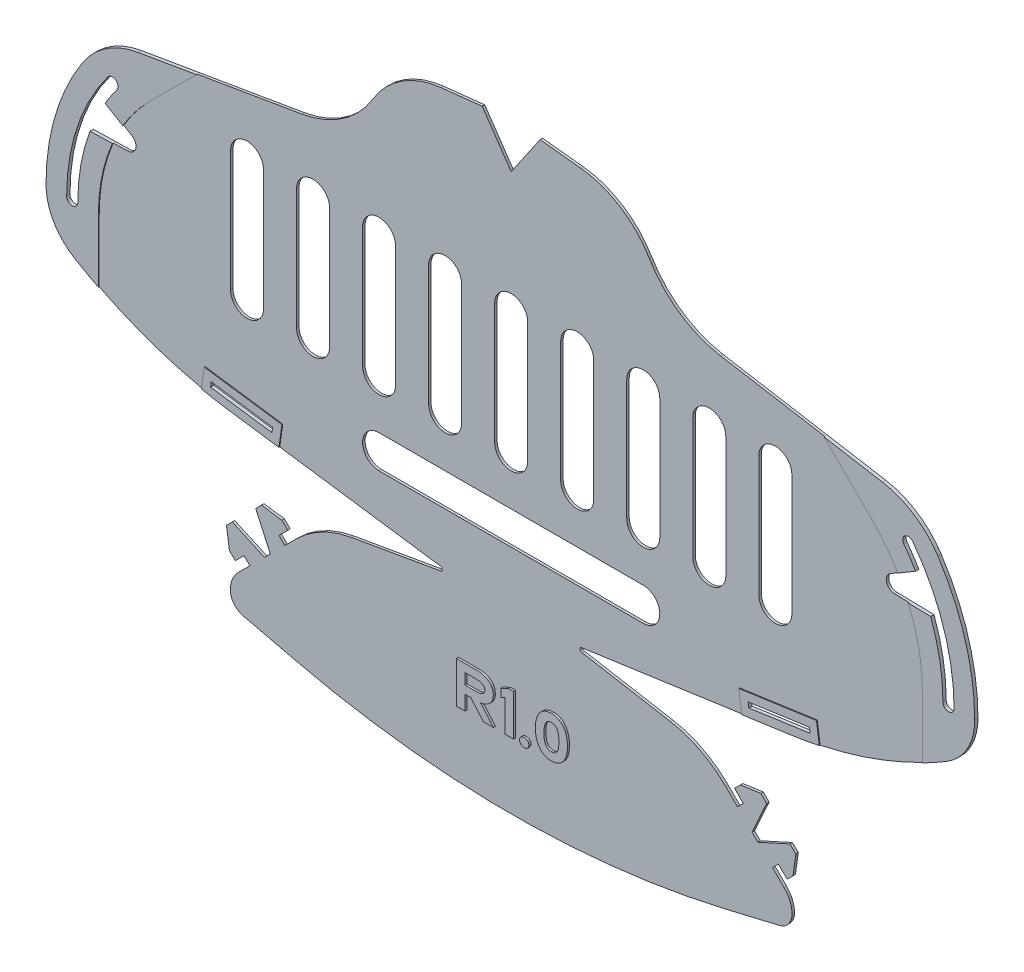
from build123d import *

# Parameters (mm, degrees)
MAIN_SHAPE_DEPTH                   = 0.6
ELASTIC_ATTACHMENT_POINTS_DEPTH    = 184.525502315
REINFORCED_ATTACHMENT_POINTS_DEPTH = 0.2
TAB_SLITS_DEPTH                    = 184.525502315
REINFORCED_TAB_SLITS_DEPTH         = 0.2
TAB_FLEX_RELIEF_DEPTH              = 184.525502315
TAB_FLEX_RELIEF_DEPTH_BACK         = 184.525502315
BREATHING_SLITS_DEPTH              = 184.525502315
VERSION_NUMBER_DEPTH               = 0.5
FILLET1_R                          = 0.5
CUT_EXTRUDE1_DEPTH                 = 184.526265229
CUT_EXTRUDE1_DEPTH_BACK            = 184.526265229


with BuildPart() as part:
    # Sketch1 → Main Shape (new body)
    with BuildSketch(Plane.XY):
        with BuildLine():
            Line((0, -10.235233266), (-7, 0))
            Line((-7, 0), (-16.941855461, -1.076805455))
            ThreePointArc((-16.941855461, -1.076805455), (-26.448172688, -4.42923559), (-33.461443341, -11.669600897))
            ThreePointArc((-33.461443341, -11.669600897), (-40.804108255, -19.481824954), (-50.74391922, -23.5))
            Line((-50.74391922, -23.5), (-90.180351554, -30.190874742))
            ThreePointArc((-90.180351554, -30.190874742), (-97.811505455, -33.190405434), (-103.597722286, -39))
            ThreePointArc((-103.597722286, -39), (-110.227482046, -53.35351039), (-112.5, -69))
            ThreePointArc((-112.5, -69), (-110.685143325, -75.893640703), (-105.711102551, -81))
            ThreePointArc((-105.711102551, -81), (-87.655491519, -89.524485559), (-68.266232563, -94.291935705))
            Line((-68.266232563, -94.291935705), (-14, -102))
            Line((-14, -102), (-38.626554922, -106.304973016))
            ThreePointArc((-38.626554922, -106.304973016), (-45.849449199, -108.748014338), (-52, -113.254607005))
            Line((-52, -113.254607005), (-54.828307349, -116.0831539))
            Line((-54.828307349, -116.0831539), (-56.242580797, -114.669000226))
            Line((-56.242580797, -114.669000226), (-54.121350285, -112.547590054))
            Line((-54.121350285, -112.547590054), (-55.535623732, -111.13343638))
            Line((-55.535623732, -111.13343638), (-60.48540114, -110.426539202))
            Line((-60.48540114, -110.426539202), (-68.970323187, -118.912179887))
            Line((-68.970323187, -118.912179887), (-68.263006804, -123.861897408))
            Line((-68.263006804, -123.861897408), (-66.848733357, -125.276051082))
            Line((-66.848733357, -125.276051082), (-64.727502845, -123.154640911))
            Line((-64.727502845, -123.154640911), (-63.313229397, -124.568794586))
            Line((-63.313229397, -124.568794586), (-66.141536747, -127.397341481))
            ThreePointArc((-66.141536747, -127.397341481), (-67.550417669, -129.506025763), (-68.045148042, -131.993340924))
            ThreePointArc((-68.045148042, -131.993340924), (-67.183295285, -134.473669911), (-64.9691321, -135.885159709))
            Line((-64.9691321, -135.885159709), (-52.436095294, -138.860716087))
            ThreePointArc((-52.436095294, -138.860716087), (-26.397134772, -143.459954927), (0, -145))
            ThreePointArc((0, -145), (26.397134772, -143.459954927), (52.436095294, -138.860716087))
            Line((52.436095294, -138.860716087), (64.9691321, -135.885159709))
            ThreePointArc((64.9691321, -135.885159709), (67.183295285, -134.473669911), (68.045148042, -131.993340924))
            ThreePointArc((68.045148042, -131.993340924), (67.550417669, -129.506025763), (66.141536747, -127.397341481))
            Line((66.141536747, -127.397341481), (63.313229397, -124.568794586))
            Line((63.313229397, -124.568794586), (64.727502845, -123.154640911))
            Line((64.727502845, -123.154640911), (66.848733357, -125.276051082))
            Line((66.848733357, -125.276051082), (68.263006804, -123.861897408))
            Line((68.263006804, -123.861897408), (68.970323187, -118.912179887))
            Line((68.970323187, -118.912179887), (60.48540114, -110.426539202))
            Line((60.48540114, -110.426539202), (55.535623732, -111.13343638))
            Line((55.535623732, -111.13343638), (54.121350285, -112.547590054))
            Line((54.121350285, -112.547590054), (56.242580797, -114.669000226))
            Line((56.242580797, -114.669000226), (54.828307349, -116.0831539))
            Line((54.828307349, -116.0831539), (52, -113.254607005))
            ThreePointArc((52, -113.254607005), (45.849449199, -108.748014338), (38.626554922, -106.304973016))
            Line((38.626554922, -106.304973016), (14, -102))
            Line((14, -102), (68.266232563, -94.291935705))
            ThreePointArc((68.266232563, -94.291935705), (87.655491519, -89.524485559), (105.711102551, -81))
            ThreePointArc((105.711102551, -81), (110.685143325, -75.893640703), (112.5, -69))
            ThreePointArc((112.5, -69), (110.227482046, -53.35351039), (103.597722286, -39))
            ThreePointArc((103.597722286, -39), (97.811505455, -33.190405434), (90.180351554, -30.190874742))
            Line((90.180351554, -30.190874742), (50.74391922, -23.5))
            ThreePointArc((50.74391922, -23.5), (40.804108255, -19.481824954), (33.461443341, -11.669600897))
            ThreePointArc((33.461443341, -11.669600897), (26.448172688, -4.42923559), (16.941855461, -1.076805455))
            Line((16.941855461, -1.076805455), (7, 0))
            Line((7, 0), (0, -10.235233266))
        make_face()
    extrude(amount=MAIN_SHAPE_DEPTH)

    # Sketch2 → Elastic Attachment Points (cut, through all)
    with BuildSketch(Plane.XY.offset(0.6)):
        with BuildLine():
            ThreePointArc((-97.5, -39), (-104.934164903, -53.188611699), (-107.5, -69))
            ThreePointArc((-107.5, -69), (-106.15, -70.35), (-104.8, -69))
            ThreePointArc((-104.8, -69), (-102.372719998, -54.042426667), (-95.34, -40.62))
            ThreePointArc((-95.34, -40.62), (-95.61, -38.73), (-97.5, -39))
        make_face()
        with BuildLine():
            ThreePointArc((97.5, -39), (104.934164903, -53.188611699), (107.5, -69))
            ThreePointArc((107.5, -69), (106.15, -70.35), (104.8, -69))
            ThreePointArc((104.8, -69), (102.372719998, -54.042426667), (95.34, -40.62))
            ThreePointArc((95.34, -40.62), (95.61, -38.73), (97.5, -39))
        make_face()
    extrude(amount=-ELASTIC_ATTACHMENT_POINTS_DEPTH, mode=Mode.SUBTRACT)

    # Sketch7 → Reinforced Attachment Points (add)
    # profile 1 of 2: a face of its own
    with BuildSketch(Plane.XY.offset(0.6)):
        with BuildLine():
            Line((-99.8, -69), (-99.8, -84.285345235))
            ThreePointArc((-99.8, -84.285345235), (-102.78333163, -82.692655957), (-105.711102551, -81))
            ThreePointArc((-105.711102551, -81), (-110.685143325, -75.893640703), (-112.5, -69))
            ThreePointArc((-112.5, -69), (-110.227482046, -53.35351039), (-103.597722286, -39))
            ThreePointArc((-103.597722286, -39), (-97.811505455, -33.190405434), (-90.180351554, -30.190874742))
            Line((-90.180351554, -30.190874742), (-76.046591346, -27.792908862))
            Line((-76.046591346, -27.792908862), (-87.320965779, -39))
            ThreePointArc((-87.320965779, -39), (-96.555837288, -52.754028999), (-99.8, -69))
        make_face()
        with BuildLine():
            ThreePointArc((-107.5, -69), (-106.15, -70.35), (-104.8, -69))
            ThreePointArc((-104.8, -69), (-102.372719998, -54.042426667), (-95.34, -40.62))
            ThreePointArc((-95.34, -40.62), (-95.61, -38.73), (-97.5, -39))
            ThreePointArc((-97.5, -39), (-104.934164903, -53.188611699), (-107.5, -69))
        make_face(mode=Mode.SUBTRACT)
    # profile 2 of 2: a face of its own
    with BuildSketch(Plane.XY.offset(0.6)):
        with BuildLine():
            Line((76.046591346, -27.792908862), (90.180351554, -30.190874742))
            ThreePointArc((90.180351554, -30.190874742), (97.811505455, -33.190405434), (103.597722286, -39))
            ThreePointArc((103.597722286, -39), (110.227482046, -53.35351039), (112.5, -69))
            ThreePointArc((112.5, -69), (110.685143325, -75.893640703), (105.711102551, -81))
            ThreePointArc((105.711102551, -81), (102.78333163, -82.692655957), (99.8, -84.285345235))
            Line((99.8, -84.285345235), (99.8, -69))
            ThreePointArc((99.8, -69), (96.555837288, -52.754028999), (87.320965779, -39))
            Line((87.320965779, -39), (76.046591346, -27.792908862))
        make_face()
        with BuildLine():
            ThreePointArc((104.8, -69), (106.15, -70.35), (107.5, -69))
            ThreePointArc((107.5, -69), (104.934164903, -53.188611699), (97.5, -39))
            ThreePointArc((97.5, -39), (95.61, -38.73), (95.34, -40.62))
            ThreePointArc((95.34, -40.62), (102.372719998, -54.042426667), (104.8, -69))
        make_face(mode=Mode.SUBTRACT)
    extrude(amount=REINFORCED_ATTACHMENT_POINTS_DEPTH)

    # Sketch6 → Tab Slits (cut, through all)
    with BuildSketch(Plane.XY.offset(0.6)):
        Polygon((-72.627441637, -91.652387373), (-57.776508424, -93.761838179), (-57.60775236, -92.573763522), (-72.458685573, -90.464312716), align=None)
        Polygon((72.627441637, -91.652387373), (72.458685573, -90.464312716), (57.60775236, -92.573763522), (57.776508424, -93.761838179), align=None)
    extrude(amount=-TAB_SLITS_DEPTH, mode=Mode.SUBTRACT)

    # Sketch9 → Reinforced Tab Slits (add)
    # profile 1 of 2: a face of its own
    with BuildSketch(Plane.XY.offset(0.6)):
        with BuildLine():
            Line((-56.077644103, -96.023222715), (-55.346367824, -90.874899201))
            Line((-55.346367824, -90.874899201), (-74.157549894, -88.20292818))
            Line((-74.157549894, -88.20292818), (-74.857329404, -93.129508476))
            ThreePointArc((-74.857329404, -93.129508476), (-71.571508598, -93.76587879), (-68.266232563, -94.291935705))
            Line((-68.266232563, -94.291935705), (-56.077644103, -96.023222715))
        make_face()
        Polygon((-57.776508424, -93.761838179), (-57.60775236, -92.573763522), (-72.458685573, -90.464312716), (-72.627441637, -91.652387373), align=None, mode=Mode.SUBTRACT)
    # profile 2 of 2: a face of its own
    with BuildSketch(Plane.XY.offset(0.6)):
        with BuildLine():
            Line((68.266232563, -94.291935705), (56.077644103, -96.023222715))
            Line((56.077644103, -96.023222715), (55.346367824, -90.874899201))
            Line((55.346367824, -90.874899201), (74.157549894, -88.20292818))
            Line((74.157549894, -88.20292818), (74.857329404, -93.129508476))
            ThreePointArc((74.857329404, -93.129508476), (71.571508598, -93.76587879), (68.266232563, -94.291935705))
        make_face()
        Polygon((57.60775236, -92.573763522), (72.458685573, -90.464312716), (72.627441637, -91.652387373), (57.776508424, -93.761838179), align=None, mode=Mode.SUBTRACT)
    extrude(amount=REINFORCED_TAB_SLITS_DEPTH)

    # Sketch11 → Tab Flex Relief (cut, two sides: drawn at the far end of the back side and taken through both)
    with BuildSketch(Plane.XY.offset(0.6).offset(-TAB_FLEX_RELIEF_DEPTH_BACK)):
        Polygon((-67.556169513, -117.49790644), (-59.777845211, -121.033110967), (-58.363691536, -119.618837519), (-61.899554814, -111.840812649), align=None)
        Polygon((61.899554814, -111.840812649), (67.556169513, -117.49790644), (59.777845211, -121.033110967), (58.363691536, -119.618837519), align=None)
    extrude(amount=TAB_FLEX_RELIEF_DEPTH + TAB_FLEX_RELIEF_DEPTH_BACK, mode=Mode.SUBTRACT)

    # Sketch3 → Breathing Slits (cut, through all)
    with BuildSketch(Plane.XY.offset(0.6)):
        with BuildLine():
            Line((4, -39.81), (4, -69))
            ThreePointArc((4, -69), (0, -73), (-4, -69))
            Line((-4, -69), (-4, -39.81))
            ThreePointArc((-4, -39.81), (0, -35.81), (4, -39.81))
        make_face()
        with BuildLine():
            Line((-12, -39.81), (-12, -69))
            ThreePointArc((-12, -69), (-16, -73), (-20, -69))
            Line((-20, -69), (-20, -39.81))
            ThreePointArc((-20, -39.81), (-16, -35.81), (-12, -39.81))
        make_face()
        with BuildLine():
            Line((-28, -39.81), (-28, -69))
            ThreePointArc((-28, -69), (-32, -73), (-36, -69))
            Line((-36, -69), (-36, -39.81))
            ThreePointArc((-36, -39.81), (-32, -35.81), (-28, -39.81))
        make_face()
        with BuildLine():
            Line((-32, -81), (32, -81))
            ThreePointArc((32, -81), (36, -85), (32, -89))
            Line((32, -89), (-32, -89))
            ThreePointArc((-32, -89), (-36, -85), (-32, -81))
        make_face()
        with BuildLine():
            Line((-44, -39.81), (-44, -69))
            ThreePointArc((-44, -69), (-48, -73), (-52, -69))
            Line((-52, -69), (-52, -39.81))
            ThreePointArc((-52, -39.81), (-48, -35.81), (-44, -39.81))
        make_face()
        with BuildLine():
            Line((-60, -39.81), (-60, -69))
            ThreePointArc((-60, -69), (-64, -73), (-68, -69))
            Line((-68, -69), (-68, -39.81))
            ThreePointArc((-68, -39.81), (-64, -35.81), (-60, -39.81))
        make_face()
        with BuildLine():
            Line((12, -39.81), (12, -69))
            ThreePointArc((12, -69), (16, -73), (20, -69))
            Line((20, -69), (20, -39.81))
            ThreePointArc((20, -39.81), (16, -35.81), (12, -39.81))
        make_face()
        with BuildLine():
            Line((28, -39.81), (28, -69))
            ThreePointArc((28, -69), (32, -73), (36, -69))
            Line((36, -69), (36, -39.81))
            ThreePointArc((36, -39.81), (32, -35.81), (28, -39.81))
        make_face()
        with BuildLine():
            Line((44, -39.81), (44, -69))
            ThreePointArc((44, -69), (48, -73), (52, -69))
            Line((52, -69), (52, -39.81))
            ThreePointArc((52, -39.81), (48, -35.81), (44, -39.81))
        make_face()
        with BuildLine():
            Line((60, -39.81), (60, -69))
            ThreePointArc((60, -69), (64, -73), (68, -69))
            Line((68, -69), (68, -39.81))
            ThreePointArc((68, -39.81), (64, -35.81), (60, -39.81))
        make_face()
    extrude(amount=-BREATHING_SLITS_DEPTH, mode=Mode.SUBTRACT)

    # Sketch8 → Version Number (add)
    # profile 1 of 4: a face of its own
    with BuildSketch(Plane.XY.offset(0.6)):
        with BuildLine():
            Line((-10.681741322, -128.5), (-10.681741322, -124.96031746))
            Line((-10.681741322, -124.96031746), (-9.300788941, -124.96031746))
            Line((-9.300788941, -124.96031746), (-6.237296878, -128.5))
            Line((-6.237296878, -128.5), (-3.792852433, -128.5))
            Line((-3.792852433, -128.5), (-6.903963545, -124.912698413))
            add(Edge.make_bspline(
                [(-6.903963545, -124.912698413), (-6.799255621, -124.895078178), (-6.591806562, -124.860168679), (-6.289238916, -124.783778525), (-5.998034631, -124.689774191), (-5.71963937, -124.575369689), (-5.455996956, -124.438707), (-5.203114232, -124.287011867), (-4.963905085, -124.113665535), (-4.737396987, -123.922601302), (-4.529738723, -123.712291799), (-4.349013572, -123.480132639), (-4.194520385, -123.228171256), (-4.06515396, -122.955944048), (-3.964392252, -122.663082802), (-3.891647722, -122.350564519), (-3.842716269, -122.019430997), (-3.831533225, -121.791597931), (-3.825813946, -121.675078603)],
                knots=[0, 0, 0, 0, 1.037747611, 2.056002633, 3.047618151, 4.027415449, 4.994700328, 5.948310896, 6.907893298, 7.879539827, 8.842705001, 9.791812035, 10.74932023, 11.726799765, 12.732658851, 13.770957398, 14.860013815, 16, 16, 16, 16], degree=3))
            add(Edge.make_bspline(
                [(-3.825813946, -121.675078603), (-3.834108362, -121.541655588), (-3.850214418, -121.282575418), (-3.913782195, -120.907840078), (-4.015708784, -120.561748304), (-4.148406787, -120.241647835), (-4.31685786, -119.950655953), (-4.519519441, -119.687046929), (-4.756626301, -119.452115374), (-5.027516009, -119.249401434), (-5.318313231, -119.071247685), (-5.624291923, -118.918557399), (-5.940292678, -118.785342731), (-6.26973033, -118.68110382), (-6.610120579, -118.59721552), (-6.963493077, -118.541120106), (-7.327833075, -118.504971788), (-7.574992625, -118.502628171), (-7.699852438, -118.501444225)],
                knots=[0, 0, 0, 0, 1.139146047, 2.211988333, 3.232091241, 4.208947077, 5.159219369, 6.089862227, 7.035822631, 7.995126754, 8.967722881, 9.939552469, 10.907870148, 11.888142145, 12.882111329, 13.893788514, 14.935986202, 16, 16, 16, 16], degree=3))
            Line((-7.699852438, -118.501444225), (-12.745233386, -118.5))
            Line((-12.745233386, -118.5), (-12.745233386, -128.5))
            Line((-12.745233386, -128.5), (-10.681741322, -128.5))
        make_face()
        with BuildLine():
            Line((-8.015074656, -123.03968254), (-10.681741322, -123.03968254))
            Line((-10.681741322, -123.03968254), (-10.681741322, -120.420634921))
            Line((-10.681741322, -120.420634921), (-8.015074656, -120.420634921))
            add(Edge.make_bspline(
                [(-8.015074656, -120.420634921), (-7.919926819, -120.423273955), (-7.735802761, -120.428380847), (-7.470361039, -120.445886846), (-7.226384032, -120.474922885), (-7.005006191, -120.516863016), (-6.804768231, -120.565737118), (-6.626946106, -120.627548611), (-6.471241633, -120.70018055), (-6.33950982, -120.786848917), (-6.225478581, -120.879127161), (-6.128094006, -120.978986719), (-6.045576121, -121.084329372), (-5.976211643, -121.195610284), (-5.929597408, -121.316238271), (-5.895035532, -121.440786876), (-5.872071664, -121.571677835), (-5.873483246, -121.661203771), (-5.874208928, -121.7072283)],
                knots=[0, 0, 0, 0, 1.623604347, 3.141896125, 4.536383348, 5.811767693, 6.983546784, 8.049010808, 9.018540002, 9.905887765, 10.731832844, 11.51670853, 12.279439544, 13.011719622, 13.743999701, 14.475813952, 15.216428818, 16, 16, 16, 16], degree=3))
            add(Edge.make_bspline(
                [(-5.874208928, -121.7072283), (-5.877554434, -121.792099267), (-5.884204751, -121.96080882), (-5.972641014, -122.207083613), (-6.12725207, -122.431407622), (-6.301201047, -122.599469449), (-6.469975526, -122.723887153), (-6.627123198, -122.802483063), (-6.803797796, -122.874816975), (-7.004565382, -122.930249626), (-7.226222025, -122.976369379), (-7.470221727, -123.009948633), (-7.736195205, -123.032926378), (-7.921024648, -123.038535497), (-8.016756594, -123.041440726)],
                knots=[0, 0, 0, 0, 1.077951474, 2.142790588, 3.282334172, 4.524568738, 5.209808815, 5.947525172, 6.757607031, 7.641027129, 8.598037232, 9.642830948, 10.779110197, 12, 12, 12, 12], degree=3))
            Line((-8.016756594, -123.041440726), (-8.015074656, -123.03968254))
        make_face(mode=Mode.SUBTRACT)
    # profile 2 of 4: a face of its own
    with BuildSketch(Plane.XY.offset(0.6)):
        Polygon((-0.135757119, -118.5), (-1.992899976, -119.357142857), (-1.992899976, -121.277777778), (-1.024646008, -120.833333333), (-1.024646008, -128.5), (1.038846056, -128.5), (1.038846056, -118.5), align=None)
    # profile 3 of 4: a face of its own
    with BuildSketch(Plane.XY.offset(0.6)):
        with BuildLine():
            add(Edge.make_bspline(
                [(4.777746382, -127.928571429), (4.773038613, -127.8508208), (4.76401536, -127.701798262), (4.709309728, -127.489692019), (4.61341897, -127.305144524), (4.482519912, -127.14843506), (4.319075053, -127.022343967), (4.125316491, -126.932637266), (3.903570869, -126.87962357), (3.747273626, -126.87151799), (3.665065461, -126.867254672)],
                knots=[0, 0, 0, 0, 1.07618677, 2.062698225, 3.005368429, 3.930199229, 4.866541513, 5.837812372, 6.862747201, 8, 8, 8, 8], degree=3))
            add(Edge.make_bspline(
                [(3.665065461, -126.867254672), (3.582866034, -126.871574509), (3.425841603, -126.879826632), (3.202596835, -126.932633053), (3.006586988, -127.02229948), (2.840863307, -127.148325108), (2.707610003, -127.304960175), (2.609462515, -127.489458482), (2.551783562, -127.702132614), (2.542425564, -127.85205491), (2.537529658, -127.930491081)],
                knots=[0, 0, 0, 0, 1.129891893, 2.158416905, 3.132935081, 4.071570457, 4.997198708, 5.93866095, 6.921551041, 8, 8, 8, 8], degree=3))
            add(Edge.make_bspline(
                [(2.537529658, -127.930491081), (2.542465559, -128.008906514), (2.551900001, -128.158789169), (2.608875175, -128.37107871), (2.708349821, -128.554097741), (2.840793246, -128.710355803), (3.006564252, -128.836558499), (3.202940727, -128.925398825), (3.425457922, -128.981956995), (3.582797414, -128.989686149), (3.665065461, -128.99372749)],
                knots=[0, 0, 0, 0, 1.079359842, 2.063080104, 2.996051645, 3.922461704, 4.861889873, 5.83723115, 6.869153774, 8, 8, 8, 8], degree=3))
            add(Edge.make_bspline(
                [(3.665065461, -128.99372749), (3.74734394, -128.98974627), (3.903960709, -128.982168033), (4.124969107, -128.925397533), (4.319100231, -128.83651451), (4.482582804, -128.710243336), (4.612706802, -128.553928897), (4.70981276, -128.370826239), (4.764356961, -128.158566213), (4.772343973, -128.008876774), (4.776526415, -127.930491081)],
                knots=[0, 0, 0, 0, 1.137041492, 2.164354101, 3.135444492, 4.0716128, 4.996271761, 5.929380785, 6.915708941, 8, 8, 8, 8], degree=3))
            Line((4.776526415, -127.930491081), (4.777746382, -127.928571429))
        make_face()
    # profile 4 of 4: a face of its own
    with BuildSketch(Plane.XY.offset(0.6)):
        with BuildLine():
            add(Edge.make_bspline(
                [(10.249761165, -118.5), (10.105395201, -118.505695671), (9.822640054, -118.51685121), (9.409505052, -118.5745591), (9.021662349, -118.680335178), (8.654460773, -118.819656178), (8.312185202, -119.003303471), (7.988392027, -119.221085059), (7.695381412, -119.487440084), (7.419926359, -119.785519386), (7.174063179, -120.12453761), (6.960627469, -120.500892889), (6.778664693, -120.912503383), (6.629743529, -121.360169436), (6.51419448, -121.844506854), (6.426440541, -122.364485904), (6.374886102, -122.921030718), (6.364229372, -123.303893775), (6.358750791, -123.500722112)],
                knots=[0, 0, 0, 0, 0.970159994, 1.900155169, 2.79438565, 3.665191596, 4.532301255, 5.397946305, 6.279238358, 7.185391655, 8.120220805, 9.085107467, 10.08639026, 11.138349125, 12.249459105, 13.427760297, 14.677622047, 16, 16, 16, 16], degree=3))
            add(Edge.make_bspline(
                [(6.358750791, -123.500722112), (6.364174181, -123.69832053), (6.374682808, -124.081196856), (6.426649877, -124.637697099), (6.514095767, -125.156966907), (6.630205624, -125.641884177), (6.778148287, -126.090648826), (6.960694912, -126.502814664), (7.174005217, -126.879260377), (7.420086397, -127.218032326), (7.694478134, -127.51659595), (7.98994568, -127.779877259), (8.311296923, -128.000979952), (8.654654228, -128.183632701), (9.021207282, -128.324409639), (9.410160361, -128.425104033), (9.821938682, -128.488808035), (10.104720056, -128.496221224), (10.248864131, -128.5)],
                knots=[0, 0, 0, 0, 1.327400251, 2.57203543, 3.750234214, 4.861247624, 5.917991082, 6.919186852, 7.883989653, 8.818737555, 9.724812096, 10.602616666, 11.47109776, 12.338132057, 13.208862319, 14.101698703, 15.032365954, 16, 16, 16, 16], degree=3))
            add(Edge.make_bspline(
                [(10.248864131, -128.5), (10.3930038, -128.496210687), (10.675776529, -128.488776824), (11.087616943, -128.425221319), (11.477039274, -128.323813307), (11.844400752, -128.184839888), (12.186790232, -128.000200623), (12.507836638, -127.779984633), (12.803235307, -127.516566079), (13.077645106, -127.218040576), (13.323725733, -126.879258594), (13.537018475, -126.502813072), (13.719640352, -126.090657611), (13.86727809, -125.641847927), (13.984590941, -125.157235462), (14.067033087, -124.637275213), (14.124689312, -124.081441513), (14.13259968, -123.698369528), (14.136681064, -123.500722112)],
                knots=[0, 0, 0, 0, 0.96765053, 1.898333634, 2.791185227, 3.666728435, 4.529238626, 5.397734515, 6.275554038, 7.181644014, 8.116407839, 9.081227075, 10.082439899, 11.139201358, 12.250233695, 13.427610983, 14.672766316, 16, 16, 16, 16], degree=3))
            add(Edge.make_bspline(
                [(14.136681064, -123.500722112), (14.132540234, -123.303845261), (14.12448353, -122.920787111), (14.067239551, -122.364907693), (13.984491357, -121.844238468), (13.86774172, -121.360205444), (13.719123756, -120.912494629), (13.537085938, -120.500894477), (13.323667761, -120.124539393), (13.077805167, -119.785511139), (12.802331929, -119.487469991), (12.509390721, -119.220977415), (12.185905859, -119.004075275), (11.844594211, -118.818455332), (11.476583648, -118.680915067), (11.088267015, -118.574534625), (10.675417937, -118.516562336), (10.392933106, -118.506550382), (10.248864131, -118.501444225)],
                knots=[0, 0, 0, 0, 1.322391154, 2.572941942, 3.750582404, 4.861863084, 5.913983562, 6.915420183, 7.880455081, 8.815427849, 9.721720359, 10.603147806, 11.468925845, 12.331628829, 13.207367743, 14.101735605, 15.031873656, 16, 16, 16, 16], degree=3))
            Line((10.248864131, -118.501444225), (10.249761165, -118.5))
        make_face()
        with BuildLine():
            add(Edge.make_bspline(
                [(10.249761165, -126.579365079), (10.180441617, -126.580142247), (10.044431291, -126.581667111), (9.846978054, -126.549518886), (9.660526959, -126.50001124), (9.486349664, -126.424863461), (9.322554303, -126.32888552), (9.17193876, -126.207295998), (9.033579737, -126.063513987), (8.906264679, -125.896932623), (8.792393376, -125.703005633), (8.693862387, -125.478827118), (8.613124972, -125.222713054), (8.543948214, -124.937433189), (8.492696849, -124.621763618), (8.454193284, -124.276117752), (8.428326621, -123.899148475), (8.424967345, -123.63702081), (8.423220621, -123.500722112)],
                knots=[0, 0, 0, 0, 0.820209436, 1.609314487, 2.362064528, 3.101854642, 3.850272983, 4.605479342, 5.3882482, 6.210255141, 7.084711649, 8.047345167, 9.106040688, 10.263495908, 11.523832392, 12.893430008, 14.384674726, 16, 16, 16, 16], degree=3))
            add(Edge.make_bspline(
                [(8.423220621, -123.500722112), (8.424974232, -123.364424703), (8.428346752, -123.102299516), (8.454122396, -122.725313211), (8.49301537, -122.378974061), (8.543311654, -122.063111109), (8.613529077, -121.778059679), (8.693832109, -121.522619394), (8.792362269, -121.298401339), (8.906396928, -121.104640769), (9.032787233, -120.937923887), (9.172749718, -120.796456824), (9.32247047, -120.674830172), (9.486310354, -120.578630118), (9.660956374, -120.50465551), (9.846323921, -120.450210023), (10.04446763, -120.423926373), (10.179910903, -120.422146526), (10.248864131, -120.421240419)],
                knots=[0, 0, 0, 0, 1.616177311, 3.108208617, 4.478528655, 5.748482895, 6.897727805, 7.956981757, 8.920123036, 9.795040793, 10.617481319, 11.394165711, 12.149770419, 12.898583529, 13.63876386, 14.394368568, 15.182584207, 16, 16, 16, 16], degree=3))
            add(Edge.make_bspline(
                [(10.248864131, -120.421240419), (10.317815766, -120.422149219), (10.45325591, -120.423934355), (10.651422131, -120.450179948), (10.836708719, -120.504762296), (11.011042065, -120.577982734), (11.1732674, -120.675595023), (11.322737158, -120.796360516), (11.462637405, -120.937948802), (11.589001717, -121.104645093), (11.703226454, -121.298351736), (11.801011735, -121.523063414), (11.884971593, -121.777554553), (11.954160692, -122.063195246), (12.004790371, -122.378948588), (12.043582486, -122.725320897), (12.069388149, -123.102297333), (12.072756301, -123.364423957), (12.07450764, -123.500722112)],
                knots=[0, 0, 0, 0, 0.817669415, 1.606129616, 2.361968767, 3.102378757, 3.843623451, 4.599462602, 5.376387978, 6.199083685, 7.074272906, 8.037713021, 9.100132017, 10.249733507, 11.520081779, 12.89082699, 14.383321233, 16, 16, 16, 16], degree=3))
            add(Edge.make_bspline(
                [(12.07450764, -123.500722112), (12.072763187, -123.637021556), (12.069408279, -123.899150658), (12.043511603, -124.276110066), (12.005108653, -124.621789015), (11.953525434, -124.937349474), (11.88538357, -125.223220708), (11.800982057, -125.478383327), (11.703195202, -125.703055181), (11.589134023, -125.896928348), (11.461844881, -126.063488884), (11.323548791, -126.207393621), (11.173184701, -126.328120602), (11.011003474, -126.425517476), (10.837138224, -126.499891817), (10.650768886, -126.549600883), (10.453579257, -126.581404352), (10.317880722, -126.580608552), (10.248864131, -126.580203806)],
                knots=[0, 0, 0, 0, 1.616177474, 3.108208932, 4.478529109, 5.739530511, 6.897596372, 7.959685938, 8.922827315, 9.797745161, 10.620185771, 11.403367596, 12.15897238, 12.899987232, 13.640167639, 14.39331481, 15.182836171, 16, 16, 16, 16], degree=3))
            Line((10.248864131, -126.580203806), (10.249761165, -126.579365079))
        make_face(mode=Mode.SUBTRACT)
    extrude(amount=VERSION_NUMBER_DEPTH)

    # Fillet1
    fillet1_edges = [part.edges().sort_by_distance(p)[0] for p in [
        (14, -102, 0.3),
        (-14, -102, 0.3),
    ]]
    fillet(fillet1_edges, radius=FILLET1_R)

    # Sketch12 → Cut-Extrude1 (cut, two sides: drawn at the far end of the back side and taken through both)
    with BuildSketch(Plane.XY.offset(0.8).offset(-CUT_EXTRUDE1_DEPTH_BACK)):
        with BuildLine():
            Line((-98.182869077, -44.8713), (-91.873075253, -48.613590691))
            ThreePointArc((-91.873075253, -48.613590691), (-90.958522115, -50.840325527), (-92.846883729, -52.333257504))
            Line((-92.846883729, -52.333257504), (-101.844457924, -52.542203931))
            ThreePointArc((-101.844457924, -52.542203931), (-100.186324227, -48.624335004), (-98.182869077, -44.8713))
        make_face()
        with BuildLine():
            Line((101.844457924, -52.542203931), (92.846883729, -52.333257504))
            ThreePointArc((92.846883729, -52.333257504), (90.958522115, -50.840325527), (91.873075253, -48.613590691))
            Line((91.873075253, -48.613590691), (98.182869077, -44.8713))
            ThreePointArc((98.182869077, -44.8713), (100.186324227, -48.624335004), (101.844457924, -52.542203931))
        make_face()
    extrude(amount=CUT_EXTRUDE1_DEPTH + CUT_EXTRUDE1_DEPTH_BACK, mode=Mode.SUBTRACT)


solid = part.part
